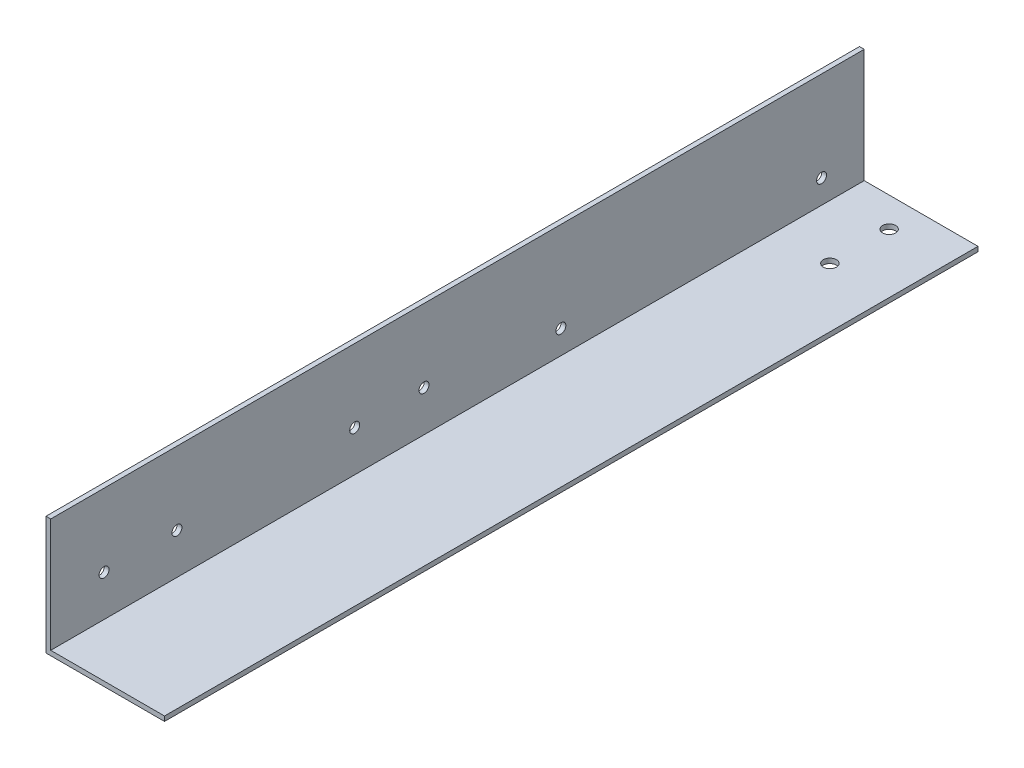
from build123d import *

# Parameters (mm, degrees)
BOSS_EXTRUDE1_DEPTH = 343.25
SKETCH2_R           = 2.1
CUT_EXTRUDE1_DEPTH  = 5
SKETCH3_R           = 2.1
CUT_EXTRUDE2_DEPTH  = 5
SKETCH4_R           = 2.75
CUT_EXTRUDE3_DEPTH  = 5


with BuildPart() as part:
    # Sketch1 → Boss-Extrude1 (new body)
    with BuildSketch(Plane.XY):
        Polygon((0, 0), (50, 0), (50, 2), (2, 2), (2, 50), (0, 50), align=None)
    extrude(amount=BOSS_EXTRUDE1_DEPTH)

    # Sketch2 → Cut-Extrude1 (cut, symmetric)
    with BuildSketch(Plane(origin=(0, 0, 0), x_dir=(0, 0, -1), z_dir=(1, 0, 0))):
        with Locations((-185.75, 19.25)):
            Circle(SKETCH2_R)
        with Locations((-215, 19.25)):
            Circle(SKETCH2_R)
        with Locations((-290, 19.25)):
            Circle(SKETCH2_R)
        with Locations((-320.75, 19.25)):
            Circle(SKETCH2_R)
    extrude(amount=CUT_EXTRUDE1_DEPTH, both=True, mode=Mode.SUBTRACT)

    # Sketch3 → Cut-Extrude2 (cut, symmetric)
    with BuildSketch(Plane(origin=(0, 0, 0), x_dir=(0, 0, -1), z_dir=(1, 0, 0))):
        with Locations((-18, 12)):
            Circle(SKETCH3_R)
        with Locations((-128, 12)):
            Circle(SKETCH3_R)
    extrude(amount=CUT_EXTRUDE2_DEPTH, both=True, mode=Mode.SUBTRACT)

    # Sketch4 → Cut-Extrude3 (cut, symmetric)
    with BuildSketch(Plane(origin=(0, 0, 0), x_dir=(1, 0, 0), z_dir=(0, 1, 0))):
        with Locations(Location((25, -12.5, 0), (0, 0, 270))):
            Circle(SKETCH4_R)
        with Locations(Location((25, -37.5, 0), (0, 0, 270))):
            Circle(SKETCH4_R)
    extrude(amount=CUT_EXTRUDE3_DEPTH, both=True, mode=Mode.SUBTRACT)


solid = part.part
